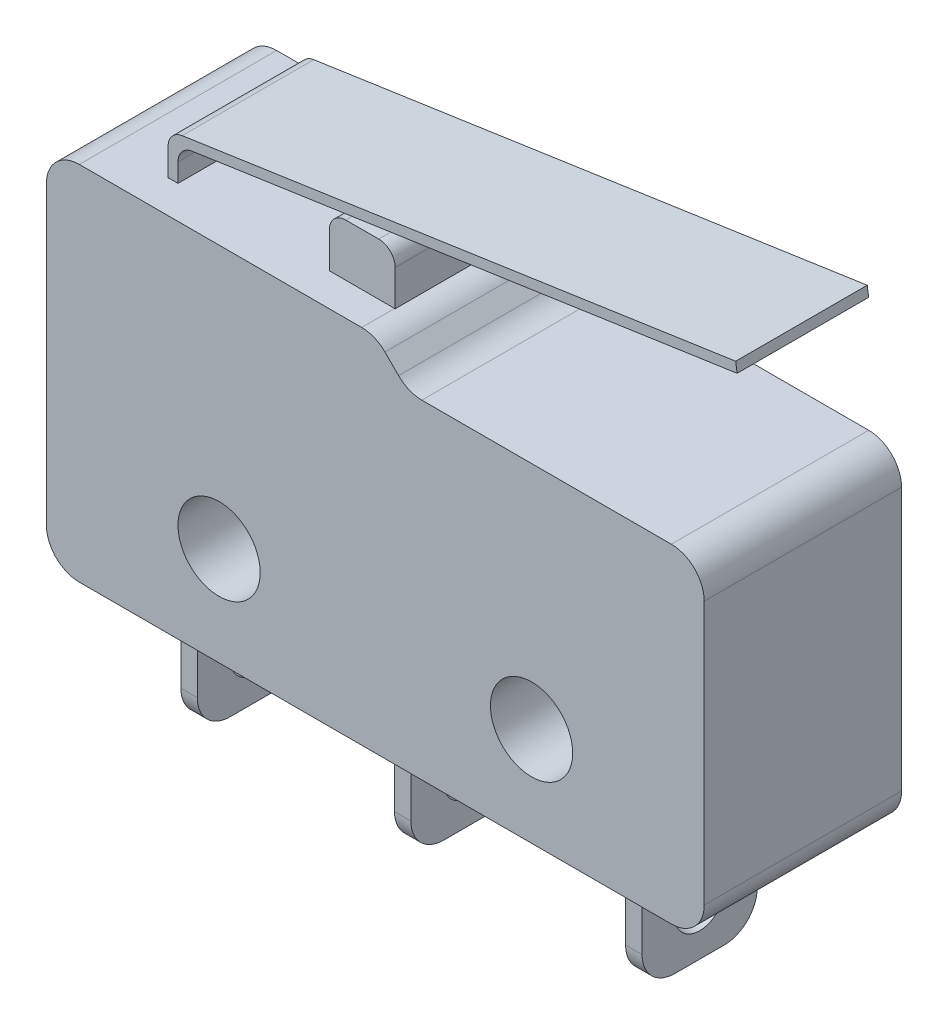
from build123d import *

# Parameters (mm, degrees)
BOSS_EXTRUDE1_DEPTH            = 4
BOSS_EXTRUDE2_DEPTH            = 1
CUT_EXTRUDE1_DEPTH             = 1
SKETCH4_W                      = 8.3
SKETCH4_H                      = 5
BOSS_EXTRUDE3_DEPTH            = 10
SKETCH5_W                      = 5
SKETCH5_H                      = 10
BOSS_EXTRUDE4_DEPTH            = 9
SKETCH6_W                      = 4
SKETCH6_H                      = 0.3
BOSS_EXTRUDE5_DEPTH            = 17.182840277
SKETCH7_W                      = 5
SKETCH7_H                      = 11
BOSS_EXTRUDE6_DEPTH            = 2.7
BOSS_EXTRUDE7_START            = 1
BOSS_EXTRUDE7_DEPTH            = 1
SKETCH9_W                      = 2
SKETCH9_H                      = 4
BOSS_EXTRUDE8_DEPTH            = 1.58656304
SKETCH10_W                     = 0.5
SKETCH10_H                     = 3.5
BOSS_EXTRUDE9_DEPTH            = 3.5
SKETCH11_W                     = 0.5
SKETCH11_H                     = 3.5
BOSS_EXTRUDE10_DEPTH           = 3.5
SKETCH12_W                     = 0.5
SKETCH12_H                     = 3.5
BOSS_EXTRUDE11_DEPTH           = 3.5
F_2_5_2_5_DIAMETER_HOLE1_D     = 2.5
F_1_5_1_5_DIAMETER_HOLE1_D     = 1.5
F_1_5_1_5_DIAMETER_HOLE1_DEPTH = 3.337462294
F_1_5_1_5_DIAMETER_HOLE2_D     = 1.5
F_1_5_1_5_DIAMETER_HOLE2_DEPTH = 0.5
F_1_5_1_5_DIAMETER_HOLE3_D     = 1.5
F_1_5_1_5_DIAMETER_HOLE3_DEPTH = 9.832640241
FILLET1_R                      = 0.5
FILLET2_R                      = 1


with BuildPart() as part:
    # Sketch1 → Boss-Extrude1 (new body)
    with BuildSketch(Plane(origin=(0, 0, 1), x_dir=(-1, 0, 0), z_dir=(0, 0, -1))):
        with BuildLine():
            Line((4.743251359, 8.08281548), (4.036144578, 7.375708699))
            Line((4.036144578, 7.375708699), (12.336144578, 7.375708699))
            Line((12.336144578, 7.375708699), (12.336144578, 9.634817645))
            Line((12.336144578, 9.634817645), (12.079792775, 9.67251644))
            Line((12.079792775, 9.67251644), (12.036144578, 9.375708699))
            Line((12.036144578, 9.375708699), (12.036144578, 8.375708699))
            Line((12.036144578, 8.375708699), (5.450358141, 8.375708699))
            ThreePointArc((5.450358141, 8.375708699), (5.067674708, 8.299588231), (4.743251359, 8.08281548))
        make_face()
    extrude(amount=-BOSS_EXTRUDE1_DEPTH)

    # Sketch2 → Boss-Extrude2 (add)
    with BuildSketch(Plane.XY.offset(5)):
        with BuildLine():
            Line((-12.336144578, 7.375708699), (-12.336144578, 9.634817645))
            Line((-12.336144578, 9.634817645), (-12.079792775, 9.67251644))
            Line((-12.079792775, 9.67251644), (-12.036144578, 9.375708699))
            Line((-12.036144578, 9.375708699), (-12.036144578, 8.375708699))
            Line((-12.036144578, 8.375708699), (-5.450358141, 8.375708699))
            ThreePointArc((-5.450358141, 8.375708699), (-5.067674708, 8.299588231), (-4.743251359, 8.08281548))
            Line((-4.743251359, 8.08281548), (-4.036144578, 7.375708699))
            Line((-4.036144578, 7.375708699), (-12.336144578, 7.375708699))
        make_face()
    extrude(amount=BOSS_EXTRUDE2_DEPTH)

    # Sketch3 → Cut-Extrude1 (cut)
    with BuildSketch(Plane.XY.offset(6)):
        Polygon((-12.036144578, 8.375708699), (-12.036144578, 9.375708699), (-12.079792775, 9.67251644), (-12.336144578, 9.634817645), (-12.336144578, 8.375708699), align=None)
    extrude(amount=-CUT_EXTRUDE1_DEPTH, mode=Mode.SUBTRACT)

    # Sketch4 → Boss-Extrude3 (add)
    with BuildSketch(Plane.XZ.offset(-7.375708699)):
        with Locations((-8.186144578, 3.5)):
            Rectangle(SKETCH4_W, SKETCH4_H)
    extrude(amount=BOSS_EXTRUDE3_DEPTH)

    # Sketch5 → Boss-Extrude4 (add)
    with BuildSketch(Plane(origin=(-4.036144578, 0, 0), x_dir=(0, 0, -1), z_dir=(1, 0, 0))):
        with Locations((-3.5, 2.375708699)):
            Rectangle(SKETCH5_W, SKETCH5_H)
    extrude(amount=BOSS_EXTRUDE4_DEPTH)

    # Sketch6 → Boss-Extrude5 (add)
    with BuildSketch(Plane(origin=(-10.431763466, -1.534082863, 0), x_dir=(0, 0, -1), z_dir=(0.9893591353648564, 0.1454939904948096, 0))):
        with Locations((-3, 11.177129757)):
            Rectangle(SKETCH6_W, SKETCH6_H)
    extrude(amount=BOSS_EXTRUDE5_DEPTH)

    # Sketch7 → Boss-Extrude6 (add)
    with BuildSketch(Plane.ZY.offset(12.336144578)):
        with Locations((3.5, 2.875708699)):
            Rectangle(SKETCH7_W, SKETCH7_H)
    extrude(amount=BOSS_EXTRUDE6_DEPTH)

    # Sketch8 → Boss-Extrude7 (add)
    with BuildSketch(Plane(origin=(0, 0, 1), x_dir=(-1, 0, 0), z_dir=(0, 0, -1)).offset(BOSS_EXTRUDE7_START)):
        with BuildLine():
            Line((15.036144578, 8.375708699), (15.036144578, -2.624291301))
            Line((15.036144578, -2.624291301), (-4.963855422, -2.624291301))
            Line((-4.963855422, -2.624291301), (-4.963855422, 7.375708699))
            Line((-4.963855422, 7.375708699), (4.036144578, 7.375708699))
            Line((4.036144578, 7.375708699), (4.743251359, 8.08281548))
            ThreePointArc((4.743251359, 8.08281548), (5.067674708, 8.299588231), (5.450358141, 8.375708699))
            Line((5.450358141, 8.375708699), (15.036144578, 8.375708699))
        make_face()
    extrude(amount=-BOSS_EXTRUDE7_DEPTH)

    # Sketch9 → Boss-Extrude8 (add)
    with BuildSketch(Plane(origin=(0, 8.375708699, 0), x_dir=(-1, 0, 0), z_dir=(0, 1, 0))):
        with Locations((6.43261709, 3)):
            Rectangle(SKETCH9_W, SKETCH9_H)
    extrude(amount=BOSS_EXTRUDE8_DEPTH)

    # Sketch10 → Boss-Extrude9 (add)
    with BuildSketch(Plane.XZ.offset(2.624291301)):
        with Locations((-5.453504337, 3)):
            Rectangle(SKETCH10_W, SKETCH10_H)
    extrude(amount=BOSS_EXTRUDE9_DEPTH)

    # Sketch11 → Boss-Extrude10 (add)
    with BuildSketch(Plane.XZ.offset(2.624291301)):
        with Locations((1.572661648, 3)):
            Rectangle(SKETCH11_W, SKETCH11_H)
    extrude(amount=BOSS_EXTRUDE10_DEPTH)

    # Sketch12 → Boss-Extrude11 (add)
    with BuildSketch(Plane.XZ.offset(2.624291301)):
        with Locations((-11.948682285, 3)):
            Rectangle(SKETCH12_W, SKETCH12_H)
    extrude(amount=BOSS_EXTRUDE11_DEPTH)

    # Ø2.5 (2.5) Diameter Hole1 (through all)
    with Locations(Plane.XY.offset(6)):
        with Locations((-9.786144578, 0.375708699), (-0.286144578, 0.375708699)):
            Hole(F_2_5_2_5_DIAMETER_HOLE1_D / 2)

    # Ø1.5 (1.5) Diameter Hole1
    with Locations(Plane(origin=(-11.698682285, 0, 0), x_dir=(0, 0, -1), z_dir=(1, 0, 0))):
        with Locations((-3, -4.624291301)):
            Hole(F_1_5_1_5_DIAMETER_HOLE1_D / 2, depth=F_1_5_1_5_DIAMETER_HOLE1_DEPTH)

    # Ø1.5 (1.5) Diameter Hole2
    with Locations(Plane(origin=(1.822661648, 0, 0), x_dir=(0, 0, -1), z_dir=(1, 0, 0))):
        with Locations((-3, -4.624291301)):
            Hole(F_1_5_1_5_DIAMETER_HOLE2_D / 2, depth=F_1_5_1_5_DIAMETER_HOLE2_DEPTH)

    # Ø1.5 (1.5) Diameter Hole3
    with Locations(Plane(origin=(-5.203504337, 0, 0), x_dir=(0, 0, -1), z_dir=(1, 0, 0))):
        with Locations((-3, -4.624291301)):
            Hole(F_1_5_1_5_DIAMETER_HOLE3_D / 2, depth=F_1_5_1_5_DIAMETER_HOLE3_DEPTH)

    # Fillet1
    fillet1_edges = [part.edges().sort_by_distance(p)[0] for p in [
        (-7.43261709, 9.962271739, 3),
        (-5.43261709, 9.962271739, 3),
        (-12.336144578, 9.634817645, 3),
        (-12.036144578, 9.375708699, 3),
    ]]
    fillet(fillet1_edges, radius=FILLET1_R)

    # Fillet2
    fillet2_edges = [part.edges().sort_by_distance(p)[0] for p in [
        (-15.036144578, -2.624291301, 3),
        (-15.036144578, 8.375708699, 3),
        (-4.036144578, 7.375708699, 3),
        (-5.453504337, -6.124291301, 1.25),
        (-5.453504337, -6.124291301, 4.75),
        (1.572661648, -6.124291301, 1.25),
        (1.572661648, -6.124291301, 4.75),
        (-11.948682285, -6.124291301, 1.25),
        (-11.948682285, -6.124291301, 4.75),
        (4.963855422, 7.375708699, 3),
        (4.963855422, -2.624291301, 3),
    ]]
    fillet(fillet2_edges, radius=FILLET2_R)


solid = part.part
